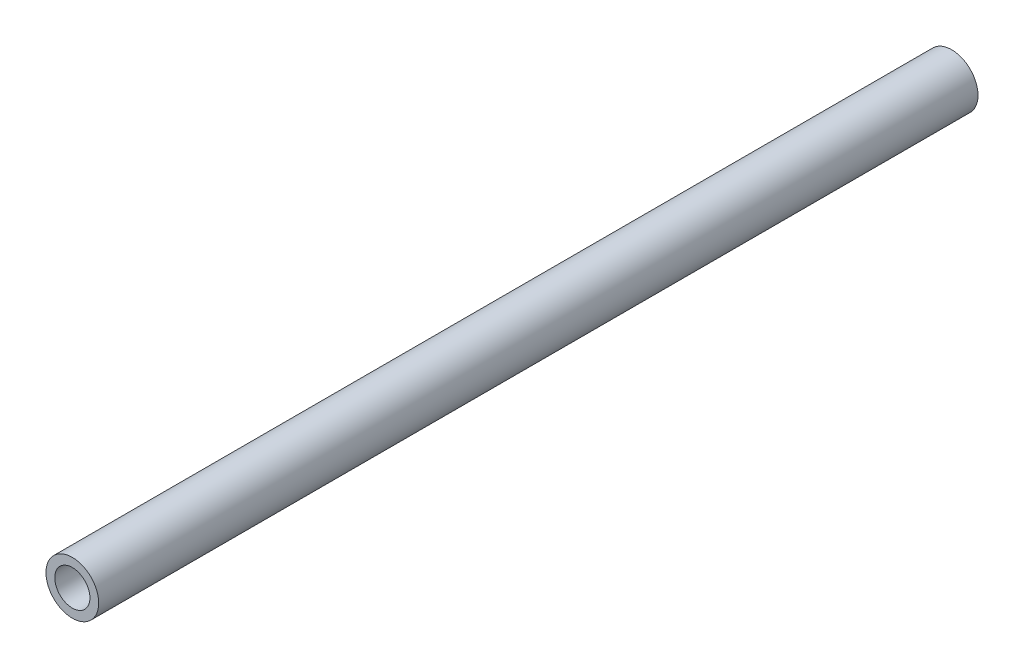
from build123d import *

# Parameters (mm, degrees)
SKETCH1_R           = 3
SKETCH1_R_2         = 2
BOSS_EXTRUDE1_DEPTH = 100


with BuildPart() as part:
    # Sketch1 → Boss-Extrude1 (new body)
    with BuildSketch(Plane.XY):
        Circle(SKETCH1_R)
        Circle(SKETCH1_R_2, mode=Mode.SUBTRACT)
    extrude(amount=BOSS_EXTRUDE1_DEPTH)


solid = part.part
